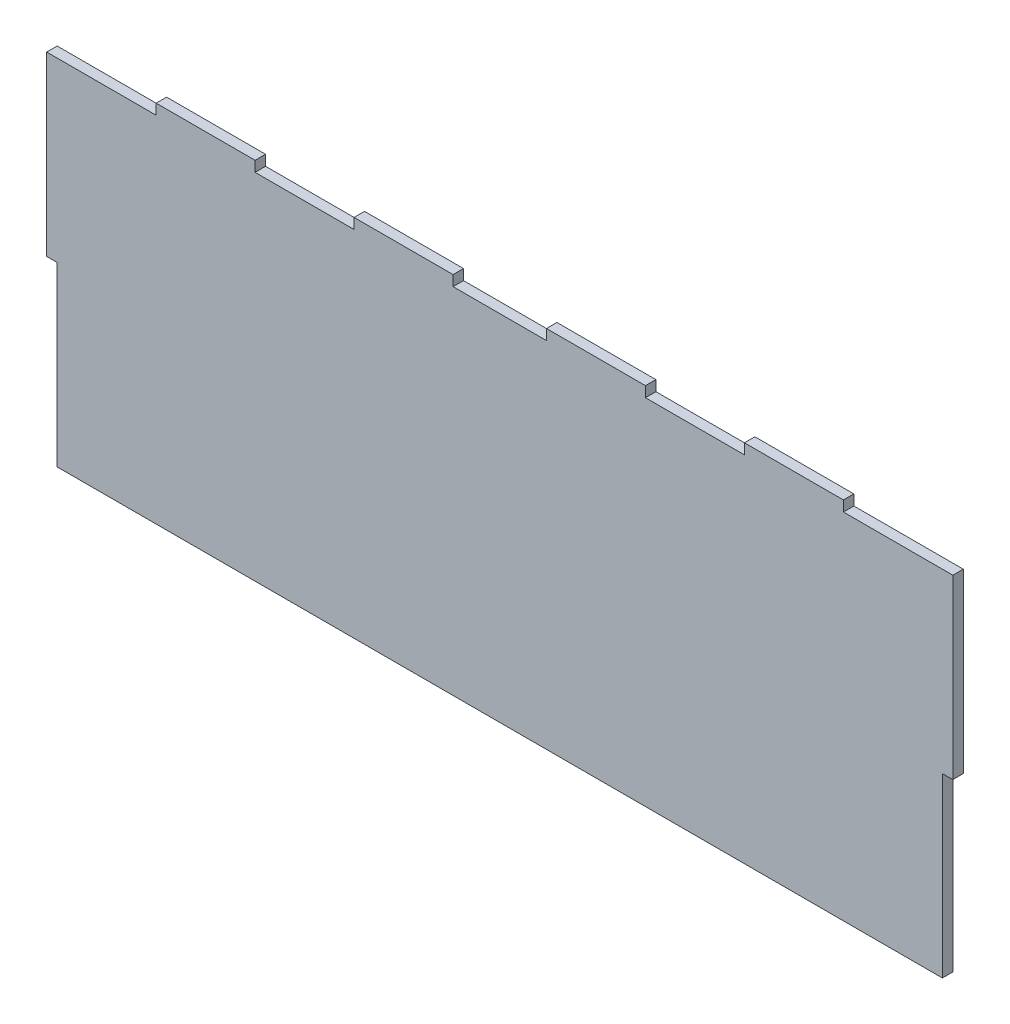
from build123d import *

# Parameters (mm, degrees)
SALIENTE_EXTRUIR1_DEPTH = 3


with BuildPart() as part:
    # Croquis1 → Saliente-Extruir1 (new body)
    with BuildSketch(Plane.XY):
        Polygon((0, 101.6), (0, 50.8), (3, 50.8), (3, 0), (257, 0), (257, 50.8), (260, 50.8), (260, 101.6), (257, 101.6), (228.6, 101.6), (228.6, 104.6), (200.2, 104.6), (200.2, 101.6), (171.8, 101.6), (171.8, 104.6), (143.4, 104.6), (143.4, 101.6), (116.6, 101.6), (116.6, 104.6), (88.2, 104.6), (88.2, 101.6), (59.8, 101.6), (59.8, 104.6), (31.4, 104.6), (31.4, 101.6), (3, 101.6), align=None)
    extrude(amount=SALIENTE_EXTRUIR1_DEPTH)


solid = part.part
